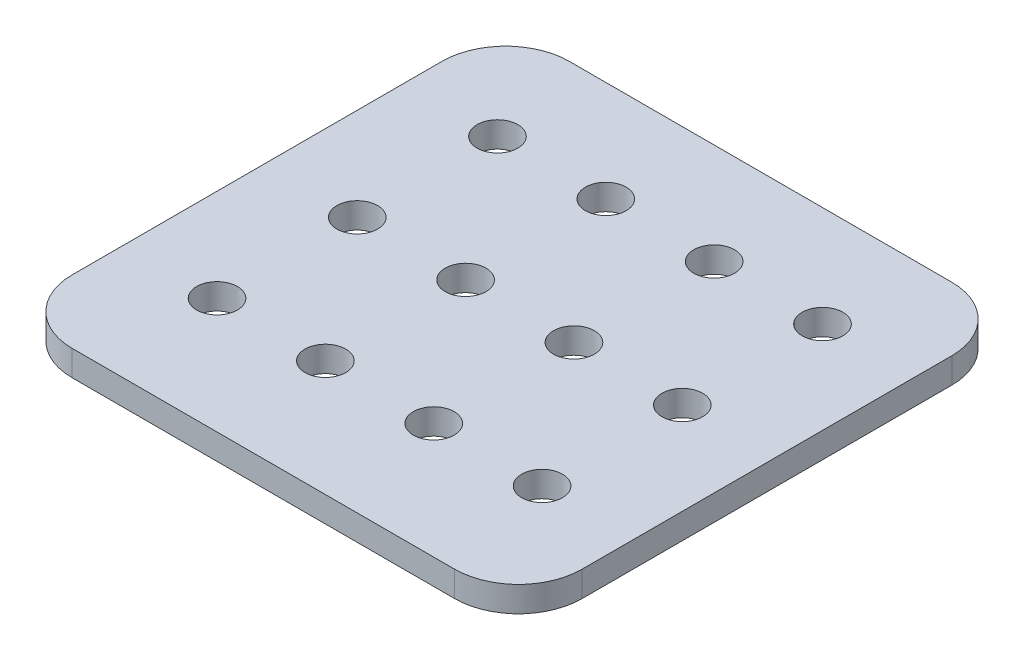
from build123d import *

# Parameters (mm, degrees)
SKETCH1_W           = 40
SKETCH1_H           = 39
SKETCH1_R           = 1.6
BOSS_EXTRUDE1_DEPTH = 2
FILLET1_R           = 5


with BuildPart() as part:
    # Sketch1 → Boss-Extrude1 (new body)
    with BuildSketch(Plane(origin=(0, 0, 0), x_dir=(1, 0, 0), z_dir=(0, 1, 0))):
        with Locations((-27.220317874, 5.659894507)):
            Rectangle(SKETCH1_W, SKETCH1_H)
        with Locations(Location((-14.44569719, 17.245220733, 0), (0, 0, 270))):
            Circle(SKETCH1_R, mode=Mode.SUBTRACT)
        with Locations(Location((-14.44569719, 6.245220733, 0), (0, 0, 270))):
            Circle(SKETCH1_R, mode=Mode.SUBTRACT)
        with Locations(Location((-14.44569719, -4.754779267, 0), (0, 0, 270))):
            Circle(SKETCH1_R, mode=Mode.SUBTRACT)
        with Locations(Location((-22.94569719, 17.245220733, 0), (0, 0, 270))):
            Circle(SKETCH1_R, mode=Mode.SUBTRACT)
        with Locations(Location((-22.94569719, 6.245220733, 0), (0, 0, 270))):
            Circle(SKETCH1_R, mode=Mode.SUBTRACT)
        with Locations(Location((-22.94569719, -4.754779267, 0), (0, 0, 270))):
            Circle(SKETCH1_R, mode=Mode.SUBTRACT)
        with Locations(Location((-31.44569719, 17.245220733, 0), (0, 0, 270))):
            Circle(SKETCH1_R, mode=Mode.SUBTRACT)
        with Locations(Location((-31.44569719, 6.245220733, 0), (0, 0, 270))):
            Circle(SKETCH1_R, mode=Mode.SUBTRACT)
        with Locations(Location((-31.44569719, -4.754779267, 0), (0, 0, 270))):
            Circle(SKETCH1_R, mode=Mode.SUBTRACT)
        with Locations(Location((-39.94569719, 17.245220733, 0), (0, 0, 270))):
            Circle(SKETCH1_R, mode=Mode.SUBTRACT)
        with Locations(Location((-39.94569719, 6.245220733, 0), (0, 0, 270))):
            Circle(SKETCH1_R, mode=Mode.SUBTRACT)
        with Locations(Location((-39.94569719, -4.754779267, 0), (0, 0, 270))):
            Circle(SKETCH1_R, mode=Mode.SUBTRACT)
    extrude(amount=BOSS_EXTRUDE1_DEPTH)

    # Fillet1
    fillet1_edges = [part.edges().sort_by_distance(p)[0] for p in [
        (-47.220317874, 1, -25.159894507),
        (-7.220317874, 1, -25.159894507),
        (-7.220317874, 1, 13.840105493),
        (-47.220317874, 1, 13.840105493),
    ]]
    fillet(fillet1_edges, radius=FILLET1_R)


solid = part.part
